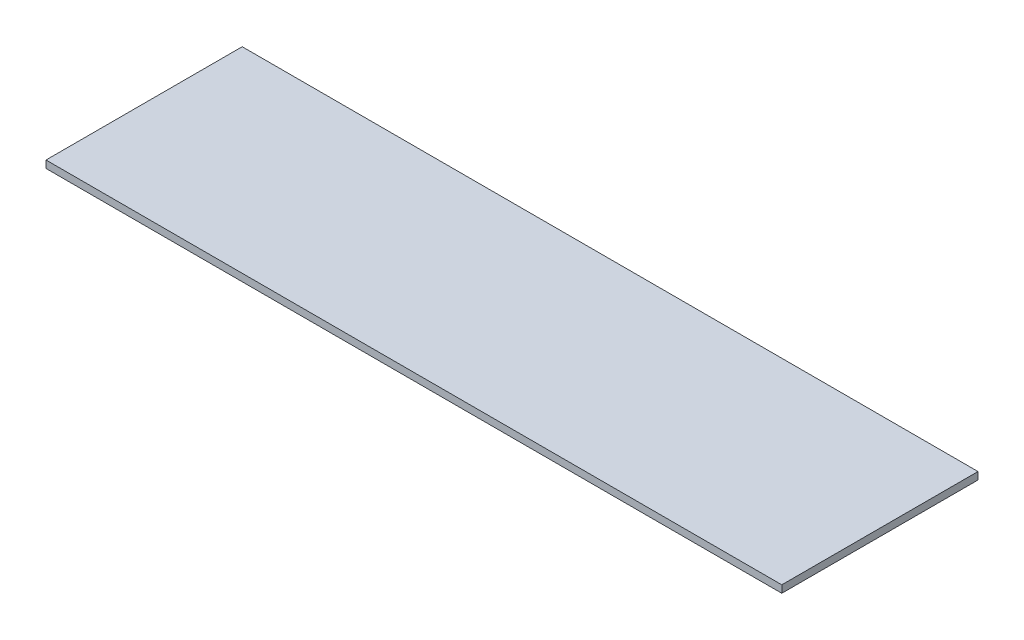
from build123d import *

# Parameters (mm, degrees)
SKETCH1_W           = 300
SKETCH1_H           = 80
BOSS_EXTRUDE1_DEPTH = 3


with BuildPart() as part:
    # Sketch1 → Boss-Extrude1 (new body)
    with BuildSketch(Plane(origin=(0, 0, 0), x_dir=(1, 0, 0), z_dir=(0, 1, 0))):
        Rectangle(SKETCH1_W, SKETCH1_H)
    extrude(amount=BOSS_EXTRUDE1_DEPTH)


solid = part.part
